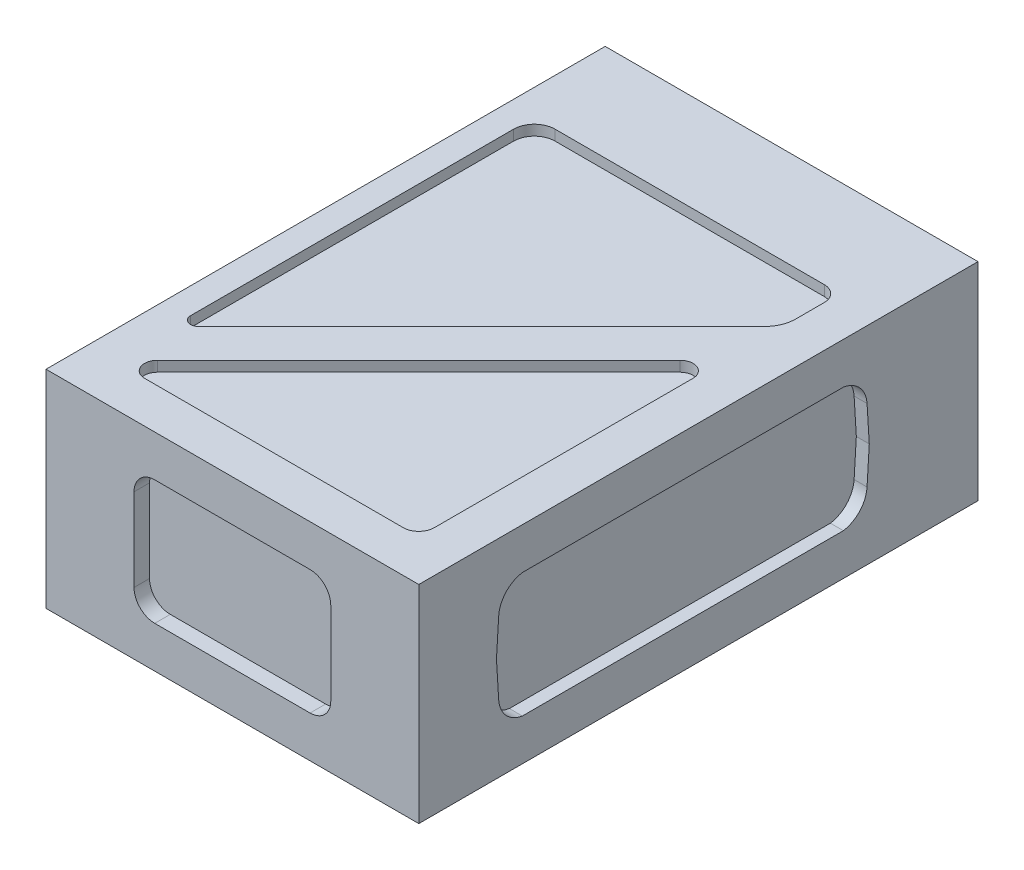
from build123d import *

# Parameters (mm, degrees)
SKETCH_1_W          = 72
SKETCH_1_H          = 40
EXTRUDE_1_DEPTH     = 108
SKETCH_1_2_W        = 72
SKETCH_1_2_H        = 40
EXTRUDE_2_DEPTH     = 105
CUT_EXTRUDE_1_DEPTH = 2.5
CUT_EXTRUDE_2_DEPTH = 2
CUT_EXTRUDE_3_DEPTH = 3


with BuildPart() as part:
    # 草图1 → 凸台-拉伸1 (new body)
    with BuildSketch(Plane.XY):
        Rectangle(SKETCH_1_W, SKETCH_1_H)
    extrude(amount=EXTRUDE_1_DEPTH)

    # 草图1<2> → 凸台-拉伸2 (add)
    with BuildSketch(Plane.XY):
        Rectangle(SKETCH_1_2_W, SKETCH_1_2_H)
    extrude(amount=EXTRUDE_2_DEPTH)

    # 草图2 → 切除-拉伸1 (cut)
    with BuildSketch(Plane.ZY.offset(36)):
        with BuildLine():
            Line((26, 12), (88, 12))
            ThreePointArc((88, 12), (91.170727435, 10.300174957), (92.572660223, 6.986943589))
            Line((92.572660223, 6.986943589), (93, 0))
            Line((93, 0), (92.572660223, -6.986943589))
            ThreePointArc((92.572660223, -6.986943589), (91.170727435, -10.300174957), (88, -12))
            Line((88, -12), (26, -12))
            ThreePointArc((26, -12), (22.829272565, -10.300174957), (21.427339777, -6.986943589))
            Line((21.427339777, -6.986943589), (21, 0))
            Line((21, 0), (21.427339777, 6.986943589))
            ThreePointArc((21.427339777, 6.986943589), (22.829272565, 10.300174957), (26, 12))
        make_face()
    cut_extrude_1 = extrude(amount=-CUT_EXTRUDE_1_DEPTH, mode=Mode.SUBTRACT)

    # 草图3 → 切除-拉伸2 (cut)
    with BuildSketch(Plane(origin=(0, 20, 0), x_dir=(1, 0, 0), z_dir=(0, 1, 0))):
        with BuildLine():
            Line((25, -100), (-24.964466094, -100))
            ThreePointArc((-24.964466094, -100), (-27.274164925, -98.456708581), (-26.732233047, -95.732233047))
            Line((-26.732233047, -95.732233047), (23.732233047, -45.267766953))
            ThreePointArc((23.732233047, -45.267766953), (26.456708581, -44.725835075), (28, -47.035533906))
            Line((28, -47.035533906), (28, -97))
            ThreePointArc((28, -97), (27.121320344, -99.121320344), (25, -100))
        make_face()
        with BuildLine():
            Line((-31, -85.064971157), (-31, -22.686291501))
            ThreePointArc((-31, -22.686291501), (-29.828427125, -19.857864376), (-27, -18.686291501))
            Line((-27, -18.686291501), (25, -18.686291501))
            ThreePointArc((25, -18.686291501), (27.121320344, -19.564971157), (28, -21.686291501))
            Line((28, -21.686291501), (28, -27.201010127))
            ThreePointArc((28, -27.201010127), (27.543277195, -29.497110721), (26.242640687, -31.443650814))
            Line((26.242640687, -31.443650814), (-28.439339828, -86.125631329))
            ThreePointArc((-28.439339828, -86.125631329), (-30.074025149, -86.450790456), (-31, -85.064971157))
        make_face()
    cut_extrude_2 = extrude(amount=-CUT_EXTRUDE_2_DEPTH, mode=Mode.SUBTRACT)

    # 镜向1: 切除-拉伸2 across plane
    add(cut_extrude_2.mirror(Plane.ZX), mode=Mode.SUBTRACT)

    # 镜向2: 切除-拉伸1 across plane
    add(cut_extrude_1.mirror(Plane.ZY), mode=Mode.SUBTRACT)

    # 草图5 → 切除-拉伸3 (cut)
    with BuildSketch(Plane.XY.offset(108)):
        with BuildLine():
            Line((15, -12), (-15, -12))
            ThreePointArc((-15, -12), (-17.828427125, -10.828427125), (-19, -8))
            Line((-19, -8), (-19, 8))
            ThreePointArc((-19, 8), (-17.828427125, 10.828427125), (-15, 12))
            Line((-15, 12), (15, 12))
            ThreePointArc((15, 12), (17.828427125, 10.828427125), (19, 8))
            Line((19, 8), (19, -8))
            ThreePointArc((19, -8), (17.828427125, -10.828427125), (15, -12))
        make_face()
    extrude(amount=-CUT_EXTRUDE_3_DEPTH, mode=Mode.SUBTRACT)


solid = part.part
